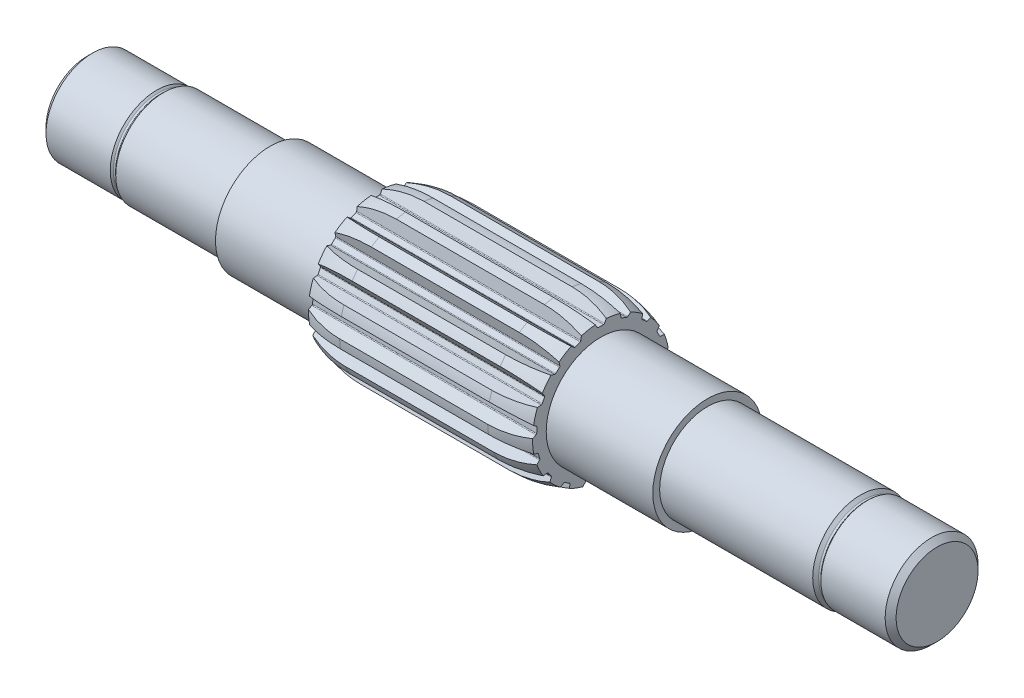
from build123d import *

# Parameters (mm, degrees)
ENL_V_MAT_EXTRU_1_REACH      = 106.328
R_P_TITION_CIRCULAIRE1_COUNT = 17
PER_AGE1_D                   = 2
PER_AGE1_DEPTH               = 6
PER_AGE1_CSINK_D             = 6
PER_AGE1_CSINK_ANGLE         = 85
PER_AGE1_TIP                 = 0.600860619


with BuildPart() as part:
    # Esquisse1 → Base-Révolution (revolve)
    with BuildSketch(Plane.XY, mode=Mode.PRIVATE) as base_r_volution_sk:
        with BuildLine():
            Line((0, 0), (0, 7.5))
            Line((0, 7.5), (1, 8.5))
            Line((1, 8.5), (12.75, 8.5))
            Line((12.75, 8.5), (13.037867966, 8.212132034))
            ThreePointArc((13.037867966, 8.212132034), (13.25, 8.124264069), (13.462132034, 8.212132034))
            Line((13.462132034, 8.212132034), (14, 8.75))
            Line((14, 8.75), (33.5, 8.75))
            Line((33.5, 8.75), (33.5, 10))
            Line((33.5, 10), (53, 10))
            Line((53, 10), (53, 12.5))
            ThreePointArc((53, 12.5), (56.424171548, 13.435019685), (59.959705454, 13.75))
            Line((59.959705454, 13.75), (87.040294546, 13.75))
            ThreePointArc((87.040294546, 13.75), (90.575828452, 13.435019685), (94, 12.5))
            Line((94, 12.5), (94, 10))
            Line((94, 10), (113.5, 10))
            Line((113.5, 10), (113.5, 8.75))
            Line((113.5, 8.75), (141.5, 8.75))
            Line((141.5, 8.75), (142.037867966, 8.212132034))
            ThreePointArc((142.037867966, 8.212132034), (142.25, 8.124264069), (142.462132034, 8.212132034))
            Line((142.462132034, 8.212132034), (142.75, 8.5))
            Line((142.75, 8.5), (154.5, 8.5))
            Line((154.5, 8.5), (155.5, 7.5))
            Line((155.5, 7.5), (155.5, 0))
            Line((155.5, 0), (0, 0))
        make_face()
    revolve(base_r_volution_sk.sketch.rotate(Axis((-10, 0, 0), (1, 0, 0)), 90), axis=Axis((-10, 0, 0), (1, 0, 0)))

    # Esquisse4 → Enlèv. mat.-Extru.1 (cut, up to next)
    with BuildSketch(Plane(origin=(53, 0, 0), x_dir=(0, 0, -1), z_dir=(1, 0, 0)), mode=Mode.PRIVATE) as enl_v_mat_extru_1_sk1:
        with BuildLine():
            Line((1.75, 13.75), (-1.75, 13.75))
            Line((-1.75, 13.75), (-0.653034489, 11.85))
            ThreePointArc((-0.653034489, 11.85), (-0.579829408, 11.776794919), (-0.479829408, 11.75))
            Line((-0.479829408, 11.75), (0.479829408, 11.75))
            ThreePointArc((0.479829408, 11.75), (0.579829408, 11.776794919), (0.653034489, 11.85))
            Line((0.653034489, 11.85), (1.75, 13.75))
        make_face()
    enl_v_mat_extru_1_tool1 = extrude(enl_v_mat_extru_1_sk1.sketch, amount=ENL_V_MAT_EXTRU_1_REACH, mode=Mode.PRIVATE) & part.part
    enl_v_mat_extru_1 = enl_v_mat_extru_1_tool1.solids().sort_by_distance((53, 12.915165, 0))[0]
    add(enl_v_mat_extru_1, mode=Mode.SUBTRACT)

    # Répétition circulaire1: Enlèv. mat.-Extru.1 ×17 about axis
    r_p_tition_circulaire1_axis = Axis((-10, 0, 0), (1, 0, 0))
    for i in range(1, R_P_TITION_CIRCULAIRE1_COUNT):
        add(enl_v_mat_extru_1.rotate(r_p_tition_circulaire1_axis, i * 360 / R_P_TITION_CIRCULAIRE1_COUNT), mode=Mode.SUBTRACT)

    # Perçage1
    with Locations(Plane.ZY):
        with Locations((0, 0)):
            CounterSinkHole(PER_AGE1_D / 2, PER_AGE1_CSINK_D / 2, depth=PER_AGE1_DEPTH, counter_sink_angle=PER_AGE1_CSINK_ANGLE)
            with Locations((0, 0, -(PER_AGE1_DEPTH + PER_AGE1_TIP / 2))):  # 118° drill point
                Cone(0, PER_AGE1_D / 2, PER_AGE1_TIP, mode=Mode.SUBTRACT)


solid = part.part
